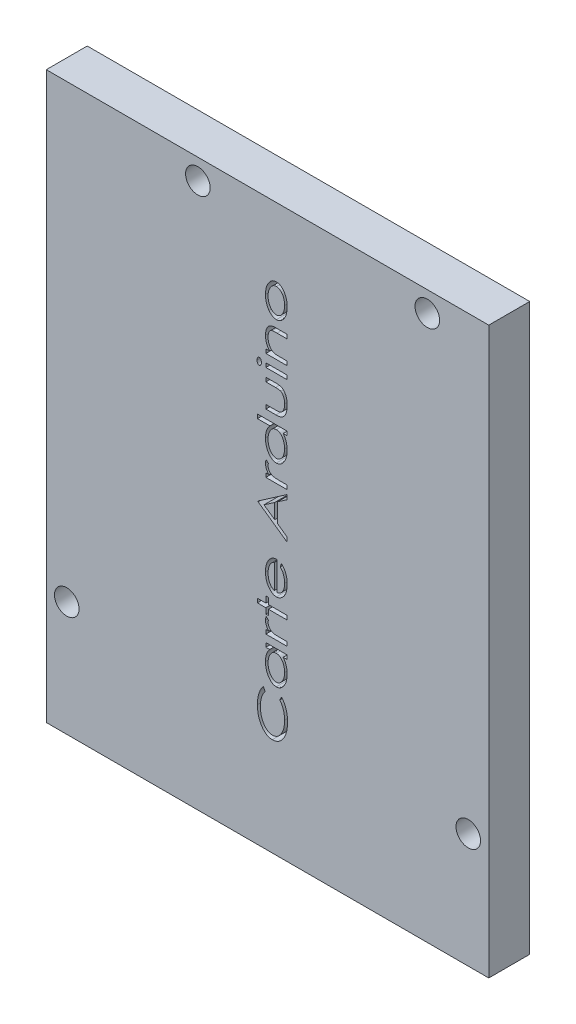
from build123d import *

# Parameters (mm, degrees)
ESQUISSE1_W             = 54
ESQUISSE1_H             = 69
EXTRUSION1_DEPTH        = 5
ESQUISSE2_W             = 2.557692307
ESQUISSE2_H             = 0.493589744
ENL_V_MAT_EXTRU_1_DEPTH = 2
ESQUISSE3_R             = 1.5
ENL_V_MAT_EXTRU_2_DEPTH = 10


with BuildPart() as part:
    # Esquisse1 → Extrusion1 (new body)
    with BuildSketch(Plane.XY):
        with Locations((-27, 34.5)):
            Rectangle(ESQUISSE1_W, ESQUISSE1_H)
    extrude(amount=EXTRUSION1_DEPTH)

    # Esquisse2 → Enlèv. mat.-Extru.1 (cut)
    # profile 1 of 13: a face of its own
    with BuildSketch(Plane.XY.offset(5)):
        with BuildLine():
            add(Edge.make_bspline(
                [(-27.247086247, 58.62309085), (-27.246056917, 58.695359189), (-27.244040574, 58.836924758), (-27.222894505, 59.044201095), (-27.190193832, 59.241931741), (-27.145057477, 59.430680366), (-27.085221102, 59.609711218), (-27.012730993, 59.779538621), (-26.927829477, 59.940485268), (-26.859649082, 60.039734744), (-26.825712048, 60.089136523)],
                knots=[0, 0, 0, 0, 1.118029041, 2.190093497, 3.220499173, 4.217871291, 5.190012594, 6.137901036, 7.073133634, 8, 8, 8, 8], degree=3))
            add(Edge.make_bspline(
                [(-26.825712048, 60.089136523), (-26.793825706, 60.131195961), (-26.731960495, 60.212798798), (-26.628242, 60.320163616), (-26.520873191, 60.411783315), (-26.409353075, 60.487943864), (-26.291948903, 60.545461323), (-26.170867758, 60.587677441), (-26.044998318, 60.612838229), (-25.959469942, 60.61612538), (-25.91635708, 60.617782356)],
                knots=[0, 0, 0, 0, 1.156785325, 2.244370538, 3.266277709, 4.248660306, 5.197713603, 6.124949243, 7.054830596, 8, 8, 8, 8], degree=3))
            add(Edge.make_bspline(
                [(-25.91635708, 60.617782356), (-25.872973596, 60.61632315), (-25.786768191, 60.613423625), (-25.660178383, 60.585192914), (-25.537529653, 60.541502956), (-25.419085821, 60.47998906), (-25.305490899, 60.400071241), (-25.195749892, 60.303632285), (-25.091270881, 60.188627856), (-24.991300429, 60.058708552), (-24.898887633, 59.915167849), (-24.819190489, 59.759421342), (-24.751002632, 59.594396123), (-24.695527997, 59.41913722), (-24.652281643, 59.234190353), (-24.621658443, 59.039226628), (-24.60324539, 58.83448484), (-24.600867211, 58.694644175), (-24.59965035, 58.62309085)],
                knots=[0, 0, 0, 0, 0.789098804, 1.567983354, 2.350210273, 3.155490411, 3.990287269, 4.874001324, 5.810856407, 6.815460693, 7.856857624, 8.915312001, 9.997439552, 11.105303834, 12.259580059, 13.453399675, 14.696961864, 16, 16, 16, 16], degree=3))
            add(Edge.make_bspline(
                [(-24.59965035, 58.62309085), (-24.600874189, 58.551304085), (-24.603270144, 58.410764539), (-24.621634473, 58.20509065), (-24.652157599, 58.009392667), (-24.695801162, 57.823859073), (-24.750698625, 57.647949192), (-24.819225002, 57.482564438), (-24.898878623, 57.326804298), (-24.991302738, 57.183267141), (-25.091270316, 57.053346936), (-25.19575003, 56.938342728), (-25.305490866, 56.841903718), (-25.419085829, 56.761985912), (-25.537529651, 56.700472013), (-25.660178383, 56.656782056), (-25.786768191, 56.628551344), (-25.872973596, 56.625651819), (-25.91635708, 56.624192613)],
                knots=[0, 0, 0, 0, 1.305249044, 2.555333257, 3.751483921, 4.903955647, 6.018189604, 7.098625447, 8.155425126, 9.195194025, 10.198227797, 11.13361828, 12.01595081, 12.849442617, 13.653463848, 14.434467899, 15.212134806, 16, 16, 16, 16], degree=3))
            add(Edge.make_bspline(
                [(-25.91635708, 56.624192613), (-25.959240149, 56.625852754), (-26.044542215, 56.62915507), (-26.170106978, 56.654414645), (-26.291175508, 56.695967174), (-26.407109931, 56.755391538), (-26.519067211, 56.830222516), (-26.62677458, 56.921415595), (-26.729809143, 57.029441458), (-26.791672732, 57.110825446), (-26.823608683, 57.152838446)],
                knots=[0, 0, 0, 0, 0.941758557, 1.873325597, 2.802242128, 3.746126364, 4.727432054, 5.755112354, 6.841117657, 8, 8, 8, 8], degree=3))
            add(Edge.make_bspline(
                [(-26.823608683, 57.152838446), (-26.857837558, 57.202204805), (-26.926530099, 57.301276146), (-27.011295639, 57.462789792), (-27.084603731, 57.632603214), (-27.144209136, 57.812327994), (-27.190515169, 58.001554775), (-27.222753325, 58.200376893), (-27.244070877, 58.408550749), (-27.246067199, 58.550586746), (-27.247086247, 58.62309085)],
                knots=[0, 0, 0, 0, 0.925913955, 1.858179155, 2.807793909, 3.776850706, 4.775415181, 5.809663793, 6.881914668, 8, 8, 8, 8], degree=3))
        make_face()
        with BuildLine():
            add(Edge.make_bspline(
                [(-26.932983683, 58.620987485), (-26.9320254, 58.570473121), (-26.930140557, 58.471116588), (-26.915718607, 58.324726045), (-26.892784311, 58.183684724), (-26.860740095, 58.047842504), (-26.818476669, 57.917816603), (-26.767016844, 57.793184754), (-26.706878334, 57.67351984), (-26.637203979, 57.561273518), (-26.561987278, 57.457904358), (-26.480912522, 57.367748769), (-26.396753644, 57.290267093), (-26.307899047, 57.227428605), (-26.215209271, 57.17804667), (-26.118262026, 57.143876142), (-26.01762337, 57.121613369), (-25.94896007, 57.119068619), (-25.914253715, 57.117782356)],
                knots=[0, 0, 0, 0, 1.211864499, 2.383612265, 3.525817359, 4.638387763, 5.728978597, 6.802613839, 7.870934821, 8.938490256, 9.969195146, 10.934099454, 11.843161065, 12.708195667, 13.538452507, 14.354344749, 15.168191808, 16, 16, 16, 16], degree=3))
            add(Edge.make_bspline(
                [(-25.914253715, 57.117782356), (-25.891796235, 57.118591174), (-25.846938457, 57.12020675), (-25.780087104, 57.129082226), (-25.714650569, 57.145920715), (-25.64972307, 57.167118897), (-25.586814105, 57.196548181), (-25.524424656, 57.230673496), (-25.464389899, 57.272756184), (-25.404834236, 57.319418556), (-25.347452976, 57.37153099), (-25.294581575, 57.42962827), (-25.243295592, 57.490849193), (-25.196145286, 57.557056557), (-25.152380658, 57.627921129), (-25.111781876, 57.702780148), (-25.074634401, 57.78217285), (-25.02948829, 57.894428026), (-24.982790766, 58.042191052), (-24.943142385, 58.227893178), (-24.917626496, 58.421626062), (-24.915057738, 58.553832192), (-24.913752914, 58.620987485)],
                knots=[0, 0, 0, 0, 0.676698543, 1.351674039, 2.02606196, 2.70946426, 3.405653627, 4.114679009, 4.848838336, 5.610721482, 6.392982434, 7.180011484, 7.97496537, 8.797371187, 9.625630927, 10.482387151, 11.360987975, 12.264255974, 14.125429088, 16.019773843, 17.978208304, 20, 20, 20, 20], degree=3))
            add(Edge.make_bspline(
                [(-24.913752914, 58.620987485), (-24.915053851, 58.688144143), (-24.917614958, 58.820352959), (-24.94318625, 59.014066385), (-24.982586966, 59.199621132), (-25.029865027, 59.347171558), (-25.074466021, 59.459634555), (-25.111789781, 59.539196033), (-25.152420717, 59.61402248), (-25.195884891, 59.684875958), (-25.243765692, 59.750530853), (-25.294321818, 59.812316776), (-25.34744446, 59.870477235), (-25.405110136, 59.922422209), (-25.463882382, 59.970170846), (-25.524926912, 60.010936325), (-25.586356693, 60.046584127), (-25.650113265, 60.074323253), (-25.714344207, 60.097341658), (-25.780298429, 60.112293942), (-25.846830863, 60.122966882), (-25.891774966, 60.123783955), (-25.914253715, 60.124192613)],
                knots=[0, 0, 0, 0, 2.021608502, 3.979865511, 5.874038621, 7.728335502, 8.638053201, 9.516574416, 10.373253009, 11.201437702, 12.018055674, 12.818372735, 13.605330473, 14.387520545, 15.15371191, 15.883845854, 16.596257792, 17.289495649, 17.975116066, 18.647787728, 19.323692347, 20, 20, 20, 20], degree=3))
            add(Edge.make_bspline(
                [(-25.914253715, 60.124192613), (-25.948962334, 60.122910636), (-26.017630114, 60.120374364), (-26.118235702, 60.098049004), (-26.215412779, 60.064080943), (-26.307701599, 60.013700671), (-26.396764407, 59.951047437), (-26.481119439, 59.873471934), (-26.56198056, 59.782627131), (-26.637012445, 59.678696399), (-26.706903203, 59.566368558), (-26.767010651, 59.446682414), (-26.818476451, 59.322055882), (-26.86074747, 59.192030121), (-26.892701114, 59.05640641), (-26.915732505, 58.915852608), (-26.930137723, 58.770157977), (-26.932024402, 58.671268059), (-26.932983683, 58.620987485)],
                knots=[0, 0, 0, 0, 0.832088621, 1.646210054, 2.46237736, 3.295543021, 4.160869255, 5.07023734, 6.039646893, 7.075221282, 8.143136624, 9.211817771, 10.28581497, 11.376773477, 12.489718964, 13.62677417, 14.793333416, 16, 16, 16, 16], degree=3))
        make_face(mode=Mode.SUBTRACT)
    # profile 2 of 13: a face of its own
    with BuildSketch(Plane.XY.offset(5)):
        with BuildLine():
            Line((-27.202214452, 52.406243895), (-27.202214452, 52.899833639))
            Line((-27.202214452, 52.899833639), (-26.740876311, 52.899833639))
            add(Edge.make_bspline(
                [(-26.740876311, 52.899833639), (-26.783101554, 52.949236619), (-26.866548769, 53.046868767), (-26.971778406, 53.207031377), (-27.059929406, 53.37409872), (-27.129809479, 53.549548525), (-27.181886544, 53.732778885), (-27.219880257, 53.923356998), (-27.242631642, 54.121804372), (-27.245585345, 54.256678819), (-27.247086247, 54.325214248)],
                knots=[0, 0, 0, 0, 1.006293527, 1.988677578, 2.962297023, 3.929401087, 4.909439067, 5.910216826, 6.938092521, 8, 8, 8, 8], degree=3))
            add(Edge.make_bspline(
                [(-27.247086247, 54.325214248), (-27.246771523, 54.360285277), (-27.246151904, 54.429332033), (-27.238565724, 54.531525017), (-27.227956202, 54.630834555), (-27.211257705, 54.726829023), (-27.192197009, 54.820250171), (-27.166701205, 54.910216606), (-27.137185758, 54.99748873), (-27.103848447, 55.08145454), (-27.066057425, 55.160903959), (-27.025338081, 55.235730019), (-26.981495325, 55.304981585), (-26.934063485, 55.368460743), (-26.884176833, 55.426996644), (-26.831224109, 55.480586433), (-26.773781302, 55.52738243), (-26.713509903, 55.570614717), (-26.646953209, 55.608173729), (-26.57219304, 55.639592131), (-26.489442006, 55.666782632), (-26.398064923, 55.689267194), (-26.298111134, 55.705371813), (-26.189857926, 55.718412116), (-26.073017317, 55.724831783), (-25.992317496, 55.726101898), (-25.950712048, 55.726756715)],
                knots=[0, 0, 0, 0, 1.149170785, 2.262451882, 3.356998706, 4.421050154, 5.454614688, 6.480458824, 7.483253189, 8.473211069, 9.439415136, 10.364928947, 11.263750434, 12.123163779, 12.959780803, 13.78303711, 14.588207165, 15.385137629, 16.211701127, 17.08670854, 18.038628498, 19.064100821, 20.167190579, 21.354800202, 22.636245781, 24, 24, 24, 24], degree=3))
            Line((-25.950712048, 55.726756715), (-24.644522145, 55.726756715))
            Line((-24.644522145, 55.726756715), (-24.644522145, 55.233166972))
            Line((-24.644522145, 55.233166972), (-25.847647145, 55.233166972))
            add(Edge.make_bspline(
                [(-25.847647145, 55.233166972), (-25.882468938, 55.232949892), (-25.949077104, 55.232534654), (-26.044463121, 55.231678734), (-26.130697351, 55.227862758), (-26.208042207, 55.223564089), (-26.276435173, 55.2194712), (-26.335704965, 55.211846076), (-26.385986658, 55.205076746), (-26.41606306, 55.197851859), (-26.429578234, 55.194605273)],
                knots=[0, 0, 0, 0, 1.430316998, 2.735952994, 3.917633013, 4.975117572, 5.918238547, 6.730267318, 7.429431135, 8, 8, 8, 8], degree=3))
            add(Edge.make_bspline(
                [(-26.429578234, 55.194605273), (-26.450076374, 55.189272524), (-26.490467075, 55.178764571), (-26.547464348, 55.154390348), (-26.600538999, 55.12471205), (-26.650123673, 55.089433768), (-26.695655873, 55.047915459), (-26.737279099, 55.000653965), (-26.774402068, 54.947502166), (-26.808299677, 54.889252231), (-26.837168446, 54.825291165), (-26.863484061, 54.757097235), (-26.884981137, 54.684126021), (-26.902446468, 54.606327929), (-26.916430141, 54.523965814), (-26.926167828, 54.436656121), (-26.931642889, 54.34491662), (-26.932530368, 54.282219305), (-26.932983683, 54.250194215)],
                knots=[0, 0, 0, 0, 0.876055379, 1.726229402, 2.558139535, 3.39066867, 4.240236547, 5.104234556, 5.993027052, 6.920950632, 7.890921188, 8.895658824, 9.945928722, 11.037651764, 12.195937577, 13.403628433, 14.673802368, 16, 16, 16, 16], degree=3))
            add(Edge.make_bspline(
                [(-26.932983683, 54.250194215), (-26.932506265, 54.21301591), (-26.931561955, 54.139478857), (-26.922206808, 54.030831775), (-26.906888202, 53.925210803), (-26.884988206, 53.822719957), (-26.857571079, 53.723012139), (-26.824935779, 53.625729237), (-26.784651773, 53.532075611), (-26.739439385, 53.441794182), (-26.689252962, 53.357347878), (-26.636909798, 53.278767171), (-26.5806804, 53.208546243), (-26.521500138, 53.145805003), (-26.459860283, 53.090088058), (-26.394957494, 53.041982918), (-26.327035923, 53.001700321), (-26.279304597, 52.980922295), (-26.255700029, 52.97064694)],
                knots=[0, 0, 0, 0, 1.167408504, 2.309082687, 3.421841772, 4.51735265, 5.598209192, 6.668245375, 7.737072533, 8.797321709, 9.837099145, 10.820367752, 11.760329686, 12.65858699, 13.526586695, 14.366288304, 15.192080716, 16, 16, 16, 16], degree=3))
            add(Edge.make_bspline(
                [(-26.255700029, 52.97064694), (-26.238505128, 52.964684474), (-26.201363617, 52.951805365), (-26.139304797, 52.939031964), (-26.068160813, 52.925756276), (-25.987062696, 52.91669266), (-25.896360684, 52.908970203), (-25.796062164, 52.90329213), (-25.685932385, 52.900966723), (-25.60926617, 52.900221899), (-25.569301792, 52.899833639)],
                knots=[0, 0, 0, 0, 0.629771554, 1.360325789, 2.190835342, 3.136705928, 4.184790911, 5.34423062, 6.615607005, 8, 8, 8, 8], degree=3))
            Line((-25.569301792, 52.899833639), (-24.644522145, 52.899833639))
            Line((-24.644522145, 52.899833639), (-24.644522145, 52.406243895))
            Line((-24.644522145, 52.406243895), (-27.202214452, 52.406243895))
        make_face()
    # profile 3 of 13: a face of its own
    with BuildSketch(Plane.XY.offset(5)):
        with BuildLine():
            add(Edge.make_bspline(
                [(-28.279137529, 51.170166171), (-28.278232265, 51.198737664), (-28.276475563, 51.254181827), (-28.261857828, 51.334160167), (-28.236136164, 51.407174208), (-28.202542431, 51.472350412), (-28.162149151, 51.527518494), (-28.115205789, 51.567784248), (-28.06359254, 51.594356392), (-28.026793572, 51.597158795), (-28.008504516, 51.598551587)],
                knots=[0, 0, 0, 0, 1.232622349, 2.391954591, 3.492533549, 4.561789548, 5.54829387, 6.421376584, 7.215425493, 8, 8, 8, 8], degree=3))
            add(Edge.make_bspline(
                [(-28.008504516, 51.598551587), (-27.990687914, 51.597124707), (-27.954580413, 51.594232963), (-27.903848526, 51.567759882), (-27.857659875, 51.527266506), (-27.81723984, 51.472383616), (-27.783686275, 51.407164732), (-27.757953146, 51.334162872), (-27.743338655, 51.254181085), (-27.741581492, 51.198737412), (-27.740675991, 51.170166171)],
                knots=[0, 0, 0, 0, 0.768134372, 1.55671721, 2.426123539, 3.417176527, 4.491362752, 5.597016362, 6.761694161, 8, 8, 8, 8], degree=3))
            add(Edge.make_bspline(
                [(-27.740675991, 51.170166171), (-27.741588883, 51.142295072), (-27.743366907, 51.088011053), (-27.758035581, 51.009436807), (-27.783839955, 50.937198575), (-27.817227026, 50.87215036), (-27.857662749, 50.817273709), (-27.903847877, 50.776778932), (-27.954580564, 50.750306169), (-27.990687963, 50.747414384), (-28.008504516, 50.745987485)],
                knots=[0, 0, 0, 0, 1.217058856, 2.370442829, 3.474794704, 4.557074952, 5.555595552, 6.431552882, 7.226077714, 8, 8, 8, 8], degree=3))
            add(Edge.make_bspline(
                [(-28.008504516, 50.745987485), (-28.02679352, 50.747380297), (-28.063592384, 50.750182741), (-28.115206448, 50.776754562), (-28.162146252, 50.817021729), (-28.202555231, 50.872183576), (-28.235982404, 50.937189184), (-28.261775448, 51.009439453), (-28.276447287, 51.088010336), (-28.278224865, 51.142294829), (-28.279137529, 51.170166171)],
                knots=[0, 0, 0, 0, 0.790458961, 1.590463383, 2.470094379, 3.463997666, 4.541273283, 5.640518464, 6.788569012, 8, 8, 8, 8], degree=3))
        make_face()
    # profile 4 of 13: a face of its own
    with BuildSketch(Plane.XY.offset(5)):
        with Locations((-25.923368299, 51.172269536)):
            Rectangle(ESQUISSE2_W, ESQUISSE2_H)
    # profile 5 of 13: a face of its own
    with BuildSketch(Plane.XY.offset(5)):
        with BuildLine():
            Line((-27.202214452, 46.528038767), (-27.202214452, 47.02162851))
            Line((-27.202214452, 47.02162851), (-26.015916375, 47.02162851))
            add(Edge.make_bspline(
                [(-26.015916375, 47.02162851), (-25.981092908, 47.022007188), (-25.914473381, 47.022731622), (-25.818599551, 47.025176728), (-25.731104432, 47.030555662), (-25.652125425, 47.039166896), (-25.581432295, 47.048777219), (-25.519234221, 47.060187454), (-25.465252313, 47.074738998), (-25.432962584, 47.087277985), (-25.417859484, 47.093142933)],
                knots=[0, 0, 0, 0, 1.380257365, 2.640520856, 3.8007194, 4.853282788, 5.78857991, 6.627858729, 7.358198781, 8, 8, 8, 8], degree=3))
            add(Edge.make_bspline(
                [(-25.417859484, 47.093142933), (-25.398702235, 47.102548211), (-25.360153301, 47.121473863), (-25.306090405, 47.157591198), (-25.255535878, 47.200099758), (-25.20752691, 47.248058987), (-25.162508579, 47.302145726), (-25.121463527, 47.362879109), (-25.082512546, 47.428897789), (-25.047948693, 47.501115943), (-25.016420589, 47.577855759), (-24.989377175, 47.658803603), (-24.965124866, 47.742836745), (-24.946446163, 47.830988457), (-24.931828947, 47.922498543), (-24.921329366, 48.017724907), (-24.914918766, 48.116457917), (-24.914145785, 48.183611247), (-24.913752914, 48.217742292)],
                knots=[0, 0, 0, 0, 0.789107134, 1.587870916, 2.398439957, 3.230141982, 4.096078469, 4.998061595, 5.939960955, 6.930173971, 7.958043701, 9.008265343, 10.086945814, 11.192947644, 12.340374094, 13.515114844, 14.737043569, 16, 16, 16, 16], degree=3))
            add(Edge.make_bspline(
                [(-24.913752914, 48.217742292), (-24.914115302, 48.251876502), (-24.914825829, 48.318802787), (-24.921615499, 48.417001997), (-24.930772785, 48.511423884), (-24.945997378, 48.601604625), (-24.96367318, 48.688433623), (-24.987175519, 48.770869342), (-25.013530813, 48.849712021), (-25.044280234, 48.923966386), (-25.078983954, 48.993097962), (-25.114641635, 49.058090816), (-25.155341004, 49.116212062), (-25.196919378, 49.169611521), (-25.241405544, 49.217435855), (-25.289503632, 49.258357036), (-25.338893563, 49.295790434), (-25.374817209, 49.315196814), (-25.3926191, 49.324813606)],
                knots=[0, 0, 0, 0, 1.295787742, 2.540626003, 3.736131532, 4.895866378, 6.011410103, 7.098644264, 8.148107331, 9.166499869, 10.14667766, 11.084406019, 11.977846222, 12.837053895, 13.653115956, 14.451967092, 15.232875428, 16, 16, 16, 16], degree=3))
            add(Edge.make_bspline(
                [(-25.3926191, 49.324813606), (-25.406527482, 49.330958264), (-25.436954963, 49.344400983), (-25.48949511, 49.359323035), (-25.55215903, 49.371533608), (-25.625195801, 49.381826569), (-25.708445895, 49.390232031), (-25.802021052, 49.395431267), (-25.905579366, 49.39898163), (-25.978052338, 49.399541257), (-26.015916375, 49.399833639)],
                knots=[0, 0, 0, 0, 0.577123795, 1.262578488, 2.068793637, 3.001746774, 4.063685736, 5.24670414, 6.561520315, 8, 8, 8, 8], degree=3))
            Line((-26.015916375, 49.399833639), (-27.202214452, 49.399833639))
            Line((-27.202214452, 49.399833639), (-27.202214452, 49.893423382))
            Line((-27.202214452, 49.893423382), (-25.957022145, 49.893423382))
            add(Edge.make_bspline(
                [(-25.957022145, 49.893423382), (-25.91469941, 49.893010197), (-25.832519716, 49.8922079), (-25.71323533, 49.882449801), (-25.60166556, 49.869184704), (-25.49822481, 49.849059223), (-25.403481421, 49.822182557), (-25.316322843, 49.791021076), (-25.237485495, 49.75299165), (-25.16590649, 49.70918776), (-25.100561319, 49.659147777), (-25.039554679, 49.603592234), (-24.982011391, 49.542331129), (-24.927570284, 49.475680775), (-24.878225543, 49.402108085), (-24.830910134, 49.32385852), (-24.788232864, 49.239083966), (-24.748987739, 49.148784366), (-24.71391632, 49.052311818), (-24.683115281, 48.95005943), (-24.65722665, 48.841894067), (-24.636441384, 48.727858337), (-24.619467128, 48.607899191), (-24.607828757, 48.481787535), (-24.60063848, 48.349872212), (-24.599984129, 48.260052886), (-24.59965035, 48.214236683)],
                knots=[0, 0, 0, 0, 1.226876808, 2.382274251, 3.468255488, 4.483625959, 5.434028297, 6.321591031, 7.164190345, 7.967304403, 8.750706248, 9.547073138, 10.357246674, 11.185942296, 12.039291661, 12.923718533, 13.835955015, 14.788963051, 15.777265547, 16.810613333, 17.883918967, 19.000404961, 20.170573262, 21.395801997, 22.671617045, 24, 24, 24, 24], degree=3))
            add(Edge.make_bspline(
                [(-24.59965035, 48.214236683), (-24.599984884, 48.168420576), (-24.600640715, 48.078601435), (-24.607820367, 47.94668478), (-24.619518014, 47.820347343), (-24.636439922, 47.699916518), (-24.657227899, 47.585180514), (-24.683123296, 47.476319826), (-24.713896696, 47.373352572), (-24.749068315, 47.276234402), (-24.787997135, 47.184947281), (-24.831938616, 47.100161471), (-24.877971587, 47.020321009), (-24.928397957, 46.946557594), (-24.9831855, 46.879159918), (-25.041668055, 46.817838413), (-25.103592258, 46.76234413), (-25.169225806, 46.711557442), (-25.241700736, 46.667450823), (-25.322681526, 46.630563924), (-25.411442295, 46.598284184), (-25.509131059, 46.57261688), (-25.614755504, 46.552283729), (-25.729131099, 46.538946159), (-25.851688119, 46.529251074), (-25.936434653, 46.52845137), (-25.980159164, 46.528038767)],
                knots=[0, 0, 0, 0, 1.313570353, 2.575158976, 3.786725367, 4.950481729, 6.0611077, 7.128961893, 8.157204859, 9.140784589, 10.089316424, 11.000395615, 11.877319077, 12.73046734, 13.559348208, 14.365098571, 15.157559091, 15.941616971, 16.741494237, 17.583943296, 18.489088665, 19.446502762, 20.476861613, 21.570682249, 22.746606786, 24, 24, 24, 24], degree=3))
            Line((-25.980159164, 46.528038767), (-27.202214452, 46.528038767))
        make_face()
    # profile 6 of 13: a face of its own
    with BuildSketch(Plane.XY.offset(5)):
        with BuildLine():
            Line((-28.234265734, 45.495987485), (-24.644522145, 45.495987485))
            Line((-24.644522145, 45.495987485), (-24.644522145, 45.002397741))
            Line((-24.644522145, 45.002397741), (-25.086929997, 45.002397741))
            add(Edge.make_bspline(
                [(-25.086929997, 45.002397741), (-25.046610113, 44.94938205), (-24.966110498, 44.843534951), (-24.864346755, 44.671586337), (-24.780853308, 44.489376889), (-24.713382385, 44.298076014), (-24.662557946, 44.097517543), (-24.626455161, 43.888184218), (-24.603108227, 43.669861158), (-24.600816784, 43.520988341), (-24.59965035, 43.445206235)],
                knots=[0, 0, 0, 0, 0.959913953, 1.916491209, 2.874041634, 3.846160317, 4.837679676, 5.853859624, 6.90753032, 8, 8, 8, 8], degree=3))
            add(Edge.make_bspline(
                [(-24.59965035, 43.445206235), (-24.600864582, 43.37785537), (-24.603251232, 43.245473084), (-24.622003706, 43.050616556), (-24.651727949, 42.863388829), (-24.693942768, 42.68335742), (-24.74840081, 42.511008854), (-24.815482772, 42.346095178), (-24.893862968, 42.188432501), (-24.984463854, 42.040549418), (-25.082662168, 41.904834235), (-25.187005892, 41.78511418), (-25.297996957, 41.684590128), (-25.414004532, 41.601721421), (-25.535583705, 41.537037309), (-25.662495163, 41.491031527), (-25.794741523, 41.462640241), (-25.884900865, 41.45924074), (-25.930379516, 41.457525946)],
                knots=[0, 0, 0, 0, 1.226021397, 2.409820796, 3.560528837, 4.675169253, 5.773241012, 6.84782229, 7.91342823, 8.975196037, 10.001589918, 10.960246305, 11.860978357, 12.721634312, 13.549600474, 14.359895992, 15.172690086, 16, 16, 16, 16], degree=3))
            add(Edge.make_bspline(
                [(-25.930379516, 41.457525946), (-25.974918403, 41.459271576), (-26.063445071, 41.462741237), (-26.193545759, 41.490860469), (-26.318405878, 41.537991319), (-26.438062434, 41.603076321), (-26.552846419, 41.686183263), (-26.661828715, 41.788507934), (-26.766043376, 41.908756023), (-26.863897187, 42.04561448), (-26.953486012, 42.194970422), (-27.031953427, 42.35381851), (-27.099121489, 42.519816245), (-27.152628853, 42.693829994), (-27.195742733, 42.874769725), (-27.225674469, 43.063438156), (-27.243220587, 43.25930693), (-27.24578415, 43.392352617), (-27.247086247, 43.459929792)],
                knots=[0, 0, 0, 0, 0.810112008, 1.610200051, 2.409779071, 3.23202922, 4.082076825, 4.982045036, 5.946842608, 6.973913408, 8.040473165, 9.113409892, 10.195590852, 11.296150651, 12.423889662, 13.578489405, 14.770055223, 16, 16, 16, 16], degree=3))
            add(Edge.make_bspline(
                [(-27.247086247, 43.459929792), (-27.245531004, 43.537590454), (-27.242482214, 43.689830946), (-27.216859615, 43.91217821), (-27.174997746, 44.123356907), (-27.125448495, 44.290873466), (-27.077927441, 44.419059471), (-27.036761068, 44.510866858), (-26.99254006, 44.600329681), (-26.944633174, 44.686995663), (-26.891480576, 44.770418513), (-26.833928524, 44.850559062), (-26.773364562, 44.928863813), (-26.729268907, 44.977887459), (-26.707222465, 45.002397741)],
                knots=[0, 0, 0, 0, 1.669663403, 3.27309055, 4.805769352, 6.294228257, 7.024219572, 7.744246808, 8.456744993, 9.169934142, 9.872633594, 10.582485752, 11.291287424, 12, 12, 12, 12], degree=3))
            Line((-26.707222465, 45.002397741), (-28.234265734, 45.002397741))
            Line((-28.234265734, 45.002397741), (-28.234265734, 45.495987485))
        make_face()
        with BuildLine():
            add(Edge.make_bspline(
                [(-26.932983683, 43.478860081), (-26.931357393, 43.411244538), (-26.92815572, 43.278130044), (-26.903139149, 43.082371365), (-26.861864788, 42.894381716), (-26.813553597, 42.744298812), (-26.768305339, 42.629459926), (-26.728959319, 42.549170199), (-26.689081145, 42.47201666), (-26.643537734, 42.400764452), (-26.596138897, 42.332726574), (-26.544147214, 42.270283166), (-26.489954629, 42.211166076), (-26.432105375, 42.157689068), (-26.372161408, 42.109702659), (-26.311559277, 42.067071877), (-26.249865006, 42.030870779), (-26.186491264, 42.002676279), (-26.123125369, 41.978662049), (-26.058409836, 41.962650351), (-25.992808697, 41.953489779), (-25.948869982, 41.951907694), (-25.926873907, 41.95111569)],
                knots=[0, 0, 0, 0, 2.015966359, 3.968826295, 5.874616381, 7.748145086, 8.664462763, 9.552923123, 10.413471098, 11.252728875, 12.072663861, 12.884741005, 13.673821861, 14.462902716, 15.231368581, 15.962219401, 16.671105762, 17.360397388, 18.028503583, 18.689446069, 19.34392613, 20, 20, 20, 20], degree=3))
            add(Edge.make_bspline(
                [(-25.926873907, 41.95111569), (-25.905105501, 41.951854202), (-25.861355163, 41.95333847), (-25.796278325, 41.963391097), (-25.731820719, 41.979841259), (-25.667951504, 42.001983091), (-25.605316685, 42.031963981), (-25.543399311, 42.068125571), (-25.481496044, 42.109889994), (-25.421656782, 42.159412216), (-25.363074184, 42.213232927), (-25.308341985, 42.272791322), (-25.256183003, 42.336073378), (-25.20712798, 42.403773718), (-25.162233262, 42.476701297), (-25.120189351, 42.553625674), (-25.081632937, 42.635121528), (-25.034878309, 42.749772888), (-24.985565502, 42.899140045), (-24.944636735, 43.085702813), (-24.918413442, 43.27806012), (-24.915317324, 43.408662441), (-24.913752914, 43.47465335)],
                knots=[0, 0, 0, 0, 0.649979245, 1.306334096, 1.961389049, 2.634595035, 3.321409752, 4.03124086, 4.774555847, 5.548432434, 6.348427785, 7.148423135, 7.961582551, 8.796405583, 9.642701596, 10.517160907, 11.41310634, 12.333269067, 14.21359944, 16.101491156, 18.030156436, 20, 20, 20, 20], degree=3))
            add(Edge.make_bspline(
                [(-24.913752914, 43.47465335), (-24.915422401, 43.541563258), (-24.918731835, 43.674199186), (-24.94358503, 43.870491645), (-24.985905731, 44.061130744), (-25.034556996, 44.214733025), (-25.0800734, 44.332901694), (-25.117879528, 44.416185586), (-25.158707237, 44.494301409), (-25.201923705, 44.567324819), (-25.248525052, 44.634836559), (-25.297338923, 44.697667523), (-25.350306814, 44.754445352), (-25.405511273, 44.806305032), (-25.46292256, 44.85285266), (-25.522632625, 44.892770119), (-25.583929971, 44.926928302), (-25.647306342, 44.954018064), (-25.712095745, 44.976240093), (-25.779058148, 44.991532799), (-25.847842221, 45.000957133), (-25.89435842, 45.001915577), (-25.917759324, 45.002397741)],
                knots=[0, 0, 0, 0, 1.987907074, 3.940640604, 5.868205707, 7.783434005, 8.722293397, 9.629808557, 10.499550393, 11.340393725, 12.149433782, 12.935771395, 13.70238882, 14.454109182, 15.185110196, 15.895839765, 16.585877225, 17.267051451, 17.941251499, 18.618449274, 19.304983272, 20, 20, 20, 20], degree=3))
            add(Edge.make_bspline(
                [(-25.917759324, 45.002397741), (-25.953147682, 45.001029411), (-26.023115472, 44.998324028), (-26.125823435, 44.977329149), (-26.224118916, 44.942937424), (-26.317403586, 44.89361091), (-26.40647883, 44.831290964), (-26.490963653, 44.754962205), (-26.570019593, 44.664248271), (-26.644657367, 44.561861822), (-26.711435744, 44.448951793), (-26.771938133, 44.329486148), (-26.821243669, 44.202935802), (-26.86198484, 44.070257952), (-26.894565531, 43.931431668), (-26.916138729, 43.786007879), (-26.931130385, 43.634589032), (-26.932357429, 43.531482947), (-26.932983683, 43.478860081)],
                knots=[0, 0, 0, 0, 0.838952033, 1.658726862, 2.475797891, 3.301530857, 4.153550984, 5.048566245, 5.995133624, 7.00310499, 8.049891089, 9.103583459, 10.176296665, 11.267009123, 12.393921279, 13.555125413, 14.752194814, 16, 16, 16, 16], degree=3))
        make_face(mode=Mode.SUBTRACT)
    # profile 7 of 13: a face of its own
    with BuildSketch(Plane.XY.offset(5)):
        with BuildLine():
            Line((-27.202214452, 39.303679792), (-27.202214452, 39.797269536))
            Line((-27.202214452, 39.797269536), (-26.825712048, 39.797269536))
            add(Edge.make_bspline(
                [(-26.825712048, 39.797269536), (-26.861074289, 39.833510817), (-26.930088836, 39.904240939), (-27.018162852, 40.019210778), (-27.092405089, 40.136106007), (-27.150016668, 40.256874637), (-27.193669279, 40.380398171), (-27.224532011, 40.506282302), (-27.243340052, 40.63477595), (-27.245832196, 40.721285726), (-27.247086247, 40.764817613)],
                knots=[0, 0, 0, 0, 1.118742704, 2.18338882, 3.19566548, 4.175678933, 5.135093587, 6.087636434, 7.037694951, 8, 8, 8, 8], degree=3))
            add(Edge.make_bspline(
                [(-27.247086247, 40.764817613), (-27.245920604, 40.798533811), (-27.243544425, 40.867264724), (-27.226365141, 40.971936928), (-27.19941613, 41.080031928), (-27.172997205, 41.151590371), (-27.159446023, 41.188295177)],
                knots=[0, 0, 0, 0, 0.930225898, 1.896277749, 2.920927934, 4, 4, 4, 4], degree=3))
            Line((-27.159446023, 41.188295177), (-26.887410766, 40.930983478))
            add(Edge.make_bspline(
                [(-26.887410766, 40.930983478), (-26.894170673, 40.907202423), (-26.907086149, 40.861766343), (-26.922115941, 40.796139478), (-26.93108299, 40.736087312), (-26.932373184, 40.698002847), (-26.932983683, 40.679981876)],
                knots=[0, 0, 0, 0, 1.159041688, 2.214464814, 3.155112748, 4, 4, 4, 4], degree=3))
            add(Edge.make_bspline(
                [(-26.932983683, 40.679981876), (-26.931386719, 40.640578057), (-26.928188489, 40.561664301), (-26.901399835, 40.444978981), (-26.859947893, 40.330185415), (-26.81111335, 40.238256608), (-26.763973954, 40.167419874), (-26.723275344, 40.116844731), (-26.677553066, 40.069877293), (-26.62734899, 40.026387204), (-26.573238859, 39.985114047), (-26.513521059, 39.948466151), (-26.449682489, 39.914476567), (-26.404726375, 39.895331115), (-26.381901952, 39.885610882)],
                knots=[0, 0, 0, 0, 1.378024059, 2.759759239, 4.170357592, 5.641627337, 6.390463309, 7.146903678, 7.91065367, 8.681861014, 9.470576576, 10.290134189, 11.13189339, 12, 12, 12, 12], degree=3))
            add(Edge.make_bspline(
                [(-26.381901952, 39.885610882), (-26.361708824, 39.878127006), (-26.317191089, 39.861628068), (-26.241293386, 39.845964022), (-26.152390016, 39.829737518), (-26.049461342, 39.818968265), (-25.932627829, 39.808803298), (-25.802134316, 39.802239422), (-25.657672789, 39.797951353), (-25.556919094, 39.797504044), (-25.504097465, 39.797269536)],
                knots=[0, 0, 0, 0, 0.582578566, 1.28435165, 2.094062736, 3.030849317, 4.085444004, 5.270940095, 6.569249588, 8, 8, 8, 8], degree=3))
            Line((-25.504097465, 39.797269536), (-24.644522145, 39.797269536))
            Line((-24.644522145, 39.797269536), (-24.644522145, 39.303679792))
            Line((-24.644522145, 39.303679792), (-27.202214452, 39.303679792))
        make_face()
    # profile 8 of 13: a face of its own
    with BuildSketch(Plane.XY.offset(5)):
        Polygon((-28.144522145, 36.342141331), (-24.644522145, 38.765218254), (-24.644522145, 38.221147741), (-25.766317016, 37.444304792), (-25.766317016, 35.120787164), (-24.644522145, 34.32992178), (-24.644522145, 33.784449023), (-28.144522145, 36.252397741), align=None)
        Polygon((-27.429377914, 36.293763927), (-26.125291375, 35.373892132), (-26.125291375, 37.196107677), align=None, mode=Mode.SUBTRACT)
    # profile 9 of 13: a face of its own
    with BuildSketch(Plane.XY.offset(5)):
        with BuildLine():
            Line((-25.452214452, 30.721247901), (-25.305679997, 31.137013126))
            add(Edge.make_bspline(
                [(-25.305679997, 31.137013126), (-25.265976513, 31.102433894), (-25.187339116, 31.033945678), (-25.081914342, 30.919351198), (-24.988199733, 30.797114244), (-24.90687413, 30.666280197), (-24.834819497, 30.528349275), (-24.773523656, 30.381677821), (-24.719827396, 30.227329654), (-24.676541695, 30.063663012), (-24.642312786, 29.890599101), (-24.616968166, 29.707115931), (-24.602341497, 29.512520746), (-24.600563273, 29.379091936), (-24.59965035, 29.31059085)],
                knots=[0, 0, 0, 0, 0.935445731, 1.852759757, 2.762714255, 3.669970841, 4.587999711, 5.52637508, 6.49345178, 7.49120904, 8.533385969, 9.628074006, 10.782275686, 12, 12, 12, 12], degree=3))
            add(Edge.make_bspline(
                [(-24.59965035, 29.31059085), (-24.60079827, 29.23482892), (-24.60303413, 29.087263756), (-24.622176765, 28.87247239), (-24.653466484, 28.670258895), (-24.697191637, 28.480694876), (-24.75416573, 28.303595923), (-24.823256752, 28.139037645), (-24.905558747, 27.987188764), (-25.000099274, 27.849832399), (-25.10215566, 27.72704456), (-25.207838749, 27.618903109), (-25.317538782, 27.527888924), (-25.430626209, 27.45303085), (-25.54737023, 27.395455929), (-25.667214826, 27.353113519), (-25.790740511, 27.327940202), (-25.874411935, 27.32459003), (-25.91635708, 27.322910562)],
                knots=[0, 0, 0, 0, 1.379272192, 2.686474949, 3.922687842, 5.102500629, 6.224838229, 7.306045987, 8.347647592, 9.363906578, 10.337001282, 11.251757705, 12.113163051, 12.927541551, 13.715417584, 14.477140973, 15.236578758, 16, 16, 16, 16], degree=3))
            add(Edge.make_bspline(
                [(-25.91635708, 27.322910562), (-25.955706923, 27.324264986), (-26.034038114, 27.32696115), (-26.149860783, 27.348505065), (-26.262030188, 27.385011866), (-26.371598997, 27.434077049), (-26.477135712, 27.498696726), (-26.579115302, 27.577410144), (-26.678582226, 27.669308522), (-26.739193932, 27.739225527), (-26.770323427, 27.775134119)],
                knots=[0, 0, 0, 0, 0.944293904, 1.879744906, 2.816641919, 3.770901605, 4.755300812, 5.779894712, 6.859778713, 8, 8, 8, 8], degree=3))
            add(Edge.make_bspline(
                [(-26.770323427, 27.775134119), (-26.808562117, 27.82415539), (-26.885388092, 27.922644823), (-26.981883066, 28.085606422), (-27.064065072, 28.260084775), (-27.131550545, 28.446655576), (-27.183128763, 28.645310285), (-27.219989151, 28.85585054), (-27.242767801, 29.078486722), (-27.245624057, 29.231074829), (-27.247086247, 29.309188606)],
                knots=[0, 0, 0, 0, 0.909462055, 1.827215008, 2.765462056, 3.729847956, 4.727405514, 5.766410213, 6.856567926, 8, 8, 8, 8], degree=3))
            add(Edge.make_bspline(
                [(-27.247086247, 29.309188606), (-27.245754783, 29.389649815), (-27.243155328, 29.54673647), (-27.218571359, 29.775902867), (-27.180053552, 29.992972267), (-27.124257546, 30.197313914), (-27.054830173, 30.390215886), (-26.967032671, 30.569437029), (-26.86504628, 30.737387336), (-26.784060548, 30.838901727), (-26.743680798, 30.889517132)],
                knots=[0, 0, 0, 0, 1.139661, 2.22499186, 3.26158507, 4.260043095, 5.222759089, 6.161673591, 7.083404477, 8, 8, 8, 8], degree=3))
            add(Edge.make_bspline(
                [(-26.743680798, 30.889517132), (-26.713714526, 30.923097255), (-26.655069212, 30.988815033), (-26.557459834, 31.075205948), (-26.453666321, 31.147381091), (-26.34539103, 31.208577435), (-26.230947292, 31.255844122), (-26.110868978, 31.289302062), (-25.98535966, 31.310975613), (-25.899618043, 31.314639182), (-25.856060606, 31.316500305)],
                knots=[0, 0, 0, 0, 1.060847693, 2.076125639, 3.065487378, 4.037719101, 5.004010916, 5.977679051, 6.972644549, 8, 8, 8, 8], degree=3))
            Line((-25.856060606, 31.316500305), (-25.856060606, 27.816500305))
            add(Edge.make_bspline(
                [(-25.856060606, 27.816500305), (-25.822277904, 27.81883117), (-25.755417062, 27.823444288), (-25.658151573, 27.846770264), (-25.565311589, 27.881053295), (-25.477615109, 27.928651787), (-25.394984302, 27.989110137), (-25.317057708, 28.061756518), (-25.243875883, 28.146858177), (-25.175603773, 28.242981244), (-25.114898319, 28.349091856), (-25.06059109, 28.461397112), (-25.01473729, 28.579999179), (-24.977888041, 28.70481015), (-24.949067493, 28.835551387), (-24.929142449, 28.972168038), (-24.915991785, 29.114721015), (-24.914509054, 29.211936063), (-24.913752914, 29.261512324)],
                knots=[0, 0, 0, 0, 0.853309836, 1.688823266, 2.513736016, 3.345012842, 4.197955707, 5.091062549, 6.027630919, 7.025902121, 8.061795113, 9.109059866, 10.171494079, 11.26687929, 12.390234416, 13.54715085, 14.74913306, 16, 16, 16, 16], degree=3))
            add(Edge.make_bspline(
                [(-24.913752914, 29.261512324), (-24.914357578, 29.31014637), (-24.915556928, 29.406611858), (-24.927290367, 29.550310402), (-24.945864841, 29.691736478), (-24.972815314, 29.829627972), (-25.004261991, 29.961522098), (-25.041465729, 30.084677759), (-25.083064752, 30.19756496), (-25.131272042, 30.302658611), (-25.189812779, 30.404500547), (-25.262895681, 30.507457893), (-25.350548576, 30.614941817), (-25.417343533, 30.684785412), (-25.452214452, 30.721247901)],
                knots=[0, 0, 0, 0, 1.093391502, 2.168738855, 3.2397243, 4.299237833, 5.326566795, 6.287473197, 7.190399802, 8.029813773, 8.884357062, 9.827627462, 10.865893017, 12, 12, 12, 12], degree=3))
        make_face()
        with BuildLine():
            add(Edge.make_bspline(
                [(-26.17016317, 30.822910562), (-26.212105827, 30.805118106), (-26.293927362, 30.770408667), (-26.405066053, 30.699950221), (-26.504108487, 30.619700837), (-26.589522292, 30.525423093), (-26.664979425, 30.418602753), (-26.730254595, 30.295740537), (-26.790022429, 30.158353941), (-26.840113447, 30.006604114), (-26.880993844, 29.845395128), (-26.911401293, 29.678439543), (-26.929079699, 29.507053095), (-26.93167208, 29.39149356), (-26.932983683, 29.333026748)],
                knots=[0, 0, 0, 0, 0.920224499, 1.795169583, 2.65168238, 3.491542319, 4.359859276, 5.290648577, 6.30061995, 7.387461693, 8.519152392, 9.662513556, 10.817359527, 12, 12, 12, 12], degree=3))
            add(Edge.make_bspline(
                [(-26.932983683, 29.333026748), (-26.932392006, 29.285093333), (-26.931230038, 29.19095914), (-26.919659372, 29.052366069), (-26.90107215, 28.91908003), (-26.874072992, 28.790862953), (-26.840673764, 28.667611619), (-26.800064005, 28.549075372), (-26.751188689, 28.436099573), (-26.712421729, 28.364514259), (-26.693200029, 28.329020337)],
                knots=[0, 0, 0, 0, 1.101802031, 2.163777495, 3.194912503, 4.193894577, 5.174089, 6.129041199, 7.072328377, 8, 8, 8, 8], degree=3))
            add(Edge.make_bspline(
                [(-26.693200029, 28.329020337), (-26.678234958, 28.303941046), (-26.648456756, 28.254037091), (-26.595728652, 28.184807649), (-26.539169854, 28.118851111), (-26.475738921, 28.058886132), (-26.407321917, 28.003078158), (-26.333670501, 27.952096614), (-26.254765276, 27.905050754), (-26.198690071, 27.87888833), (-26.17016317, 27.865578831)],
                knots=[0, 0, 0, 0, 0.98526739, 1.960531485, 2.933654632, 3.915884192, 4.902982407, 5.91203823, 6.937800093, 8, 8, 8, 8], degree=3))
            Line((-26.17016317, 27.865578831), (-26.17016317, 30.822910562))
        make_face(mode=Mode.SUBTRACT)
    # profile 10 of 13: a face of its own
    with BuildSketch(Plane.XY.offset(5)):
        Polygon((-28.234265734, 25.528038767), (-28.234265734, 26.02162851), (-27.202214452, 26.02162851), (-27.202214452, 26.784449023), (-26.888111888, 26.784449023), (-26.888111888, 26.02162851), (-24.644522145, 26.02162851), (-24.644522145, 25.528038767), (-26.888111888, 25.528038767), (-26.888111888, 24.854961844), (-27.202214452, 24.854961844), (-27.202214452, 25.528038767), align=None)
    # profile 11 of 13: a face of its own
    with BuildSketch(Plane.XY.offset(5)):
        with BuildLine():
            Line((-27.202214452, 22.745987485), (-27.202214452, 23.239577228))
            Line((-27.202214452, 23.239577228), (-26.825712048, 23.239577228))
            add(Edge.make_bspline(
                [(-26.825712048, 23.239577228), (-26.861074289, 23.275818509), (-26.930088836, 23.346548632), (-27.018162852, 23.46151847), (-27.092405089, 23.578413699), (-27.150016668, 23.69918233), (-27.193669279, 23.822705863), (-27.224532011, 23.948589994), (-27.243340052, 24.077083642), (-27.245832196, 24.163593418), (-27.247086247, 24.207125305)],
                knots=[0, 0, 0, 0, 1.118742704, 2.18338882, 3.19566548, 4.175678933, 5.135093587, 6.087636434, 7.037694951, 8, 8, 8, 8], degree=3))
            add(Edge.make_bspline(
                [(-27.247086247, 24.207125305), (-27.245920604, 24.240841503), (-27.243544425, 24.309572416), (-27.226365141, 24.414244621), (-27.19941613, 24.52233962), (-27.172997205, 24.593898063), (-27.159446023, 24.630602869)],
                knots=[0, 0, 0, 0, 0.930225898, 1.896277749, 2.920927934, 4, 4, 4, 4], degree=3))
            Line((-27.159446023, 24.630602869), (-26.887410766, 24.373291171))
            add(Edge.make_bspline(
                [(-26.887410766, 24.373291171), (-26.894170673, 24.349510115), (-26.907086149, 24.304074035), (-26.922115941, 24.23844717), (-26.93108299, 24.178395005), (-26.932373184, 24.14031054), (-26.932983683, 24.122289568)],
                knots=[0, 0, 0, 0, 1.159041688, 2.214464814, 3.155112748, 4, 4, 4, 4], degree=3))
            add(Edge.make_bspline(
                [(-26.932983683, 24.122289568), (-26.931386719, 24.082885749), (-26.928188489, 24.003971993), (-26.901399835, 23.887286673), (-26.859947893, 23.772493107), (-26.81111335, 23.680564301), (-26.763973954, 23.609727566), (-26.723275344, 23.559152423), (-26.677553066, 23.512184986), (-26.62734899, 23.468694896), (-26.573238859, 23.42742174), (-26.513521059, 23.390773843), (-26.449682489, 23.356784259), (-26.404726375, 23.337638807), (-26.381901952, 23.327918574)],
                knots=[0, 0, 0, 0, 1.378024059, 2.759759239, 4.170357592, 5.641627337, 6.390463309, 7.146903678, 7.91065367, 8.681861014, 9.470576576, 10.290134189, 11.13189339, 12, 12, 12, 12], degree=3))
            add(Edge.make_bspline(
                [(-26.381901952, 23.327918574), (-26.361708824, 23.320434699), (-26.317191089, 23.30393576), (-26.241293386, 23.288271714), (-26.152390016, 23.27204521), (-26.049461342, 23.261275957), (-25.932627829, 23.25111099), (-25.802134316, 23.244547114), (-25.657672789, 23.240259045), (-25.556919094, 23.239811736), (-25.504097465, 23.239577228)],
                knots=[0, 0, 0, 0, 0.582578566, 1.28435165, 2.094062736, 3.030849317, 4.085444004, 5.270940095, 6.569249588, 8, 8, 8, 8], degree=3))
            Line((-25.504097465, 23.239577228), (-24.644522145, 23.239577228))
            Line((-24.644522145, 23.239577228), (-24.644522145, 22.745987485))
            Line((-24.644522145, 22.745987485), (-27.202214452, 22.745987485))
        make_face()
    # profile 12 of 13: a face of its own
    with BuildSketch(Plane.XY.offset(5)):
        with BuildLine():
            Line((-27.202214452, 21.848551587), (-24.644522145, 21.848551587))
            Line((-24.644522145, 21.848551587), (-24.644522145, 21.354961844))
            Line((-24.644522145, 21.354961844), (-25.086929997, 21.354961844))
            add(Edge.make_bspline(
                [(-25.086929997, 21.354961844), (-25.046610113, 21.301946152), (-24.966110498, 21.196099054), (-24.864346755, 21.024150439), (-24.780853308, 20.841940992), (-24.713382385, 20.650640117), (-24.662557946, 20.450081646), (-24.626455161, 20.24074832), (-24.603108227, 20.02242526), (-24.600816784, 19.873552444), (-24.59965035, 19.797770337)],
                knots=[0, 0, 0, 0, 0.959913953, 1.916491209, 2.874041634, 3.846160317, 4.837679676, 5.853859624, 6.90753032, 8, 8, 8, 8], degree=3))
            add(Edge.make_bspline(
                [(-24.59965035, 19.797770337), (-24.600864582, 19.730419472), (-24.603251232, 19.598037186), (-24.622003706, 19.403180658), (-24.651727949, 19.215952932), (-24.693942768, 19.035921522), (-24.74840081, 18.863572956), (-24.815482772, 18.69865928), (-24.893862968, 18.540996603), (-24.984463854, 18.393113521), (-25.082662168, 18.257398337), (-25.187005892, 18.137678282), (-25.297996957, 18.03715423), (-25.414004532, 17.954285523), (-25.535583705, 17.889601411), (-25.662495163, 17.84359563), (-25.794741523, 17.815204344), (-25.884900865, 17.811804843), (-25.930379516, 17.810090049)],
                knots=[0, 0, 0, 0, 1.226021397, 2.409820796, 3.560528837, 4.675169253, 5.773241012, 6.84782229, 7.91342823, 8.975196037, 10.001589918, 10.960246305, 11.860978357, 12.721634312, 13.549600474, 14.359895992, 15.172690086, 16, 16, 16, 16], degree=3))
            add(Edge.make_bspline(
                [(-25.930379516, 17.810090049), (-25.974918403, 17.811835679), (-26.063445071, 17.815305339), (-26.193545759, 17.843424572), (-26.318405878, 17.890555421), (-26.438062434, 17.955640423), (-26.552846419, 18.038747366), (-26.661828715, 18.141072036), (-26.766043376, 18.261320126), (-26.863897187, 18.398178583), (-26.953486012, 18.547534524), (-27.031953427, 18.706382612), (-27.099121489, 18.872380348), (-27.152628853, 19.046394097), (-27.195742733, 19.227333828), (-27.225674469, 19.416002258), (-27.243220587, 19.611871033), (-27.24578415, 19.744916719), (-27.247086247, 19.812493895)],
                knots=[0, 0, 0, 0, 0.810112008, 1.610200051, 2.409779071, 3.23202922, 4.082076825, 4.982045036, 5.946842608, 6.973913408, 8.040473165, 9.113409892, 10.195590852, 11.296150651, 12.423889662, 13.578489405, 14.770055223, 16, 16, 16, 16], degree=3))
            add(Edge.make_bspline(
                [(-27.247086247, 19.812493895), (-27.245632836, 19.890137271), (-27.242784945, 20.042275781), (-27.21972085, 20.264628533), (-27.179948866, 20.4754201), (-27.135527016, 20.643473829), (-27.090349753, 20.771384873), (-27.052348153, 20.863549169), (-27.010090324, 20.95298126), (-26.963677009, 21.03973687), (-26.911001015, 21.122727846), (-26.855040881, 21.203321276), (-26.795075105, 21.281596559), (-26.751027672, 21.330472192), (-26.728957241, 21.354961844)],
                knots=[0, 0, 0, 0, 1.676650023, 3.285316155, 4.820724149, 6.305932629, 7.033876271, 7.749056499, 8.458011427, 9.169405716, 9.872424542, 10.579508399, 11.288247687, 12, 12, 12, 12], degree=3))
            Line((-26.728957241, 21.354961844), (-27.202214452, 21.354961844))
            Line((-27.202214452, 21.354961844), (-27.202214452, 21.848551587))
        make_face()
        with BuildLine():
            add(Edge.make_bspline(
                [(-26.932983683, 19.831424183), (-26.931357393, 19.763808641), (-26.92815572, 19.630694146), (-26.903139149, 19.434935468), (-26.861864788, 19.246945818), (-26.813553597, 19.096862914), (-26.768305339, 18.982024028), (-26.728959319, 18.901734302), (-26.689081145, 18.824580762), (-26.643537734, 18.753328555), (-26.596138897, 18.685290676), (-26.544147214, 18.622847269), (-26.489954629, 18.563730178), (-26.432105375, 18.510253171), (-26.372161408, 18.462266762), (-26.311559277, 18.419635979), (-26.249865006, 18.383434882), (-26.186491264, 18.355240382), (-26.123125369, 18.331226152), (-26.058409836, 18.315214454), (-25.992808697, 18.306053881), (-25.948869982, 18.304471797), (-25.926873907, 18.303679792)],
                knots=[0, 0, 0, 0, 2.015966359, 3.968826295, 5.874616381, 7.748145086, 8.664462763, 9.552923123, 10.413471098, 11.252728875, 12.072663861, 12.884741005, 13.673821861, 14.462902716, 15.231368581, 15.962219401, 16.671105762, 17.360397388, 18.028503583, 18.689446069, 19.34392613, 20, 20, 20, 20], degree=3))
            add(Edge.make_bspline(
                [(-25.926873907, 18.303679792), (-25.905105501, 18.304418304), (-25.861355163, 18.305902573), (-25.796278325, 18.315955199), (-25.731820719, 18.332405361), (-25.667951504, 18.354547194), (-25.605316685, 18.384528084), (-25.543399311, 18.420689673), (-25.481496044, 18.462454096), (-25.421656782, 18.511976319), (-25.363074184, 18.565797029), (-25.308341985, 18.625355425), (-25.256183003, 18.688637481), (-25.20712798, 18.75633782), (-25.162233262, 18.8292654), (-25.120189351, 18.906189777), (-25.081632937, 18.987685631), (-25.034878309, 19.102336991), (-24.985565502, 19.251704148), (-24.944636735, 19.438266915), (-24.918413442, 19.630624223), (-24.915317324, 19.761226544), (-24.913752914, 19.827217453)],
                knots=[0, 0, 0, 0, 0.649979245, 1.306334096, 1.961389049, 2.634595035, 3.321409752, 4.03124086, 4.774555847, 5.548432434, 6.348427785, 7.148423135, 7.961582551, 8.796405583, 9.642701596, 10.517160907, 11.41310634, 12.333269067, 14.21359944, 16.101491156, 18.030156436, 20, 20, 20, 20], degree=3))
            add(Edge.make_bspline(
                [(-24.913752914, 19.827217453), (-24.915422401, 19.894127361), (-24.918731835, 20.026763289), (-24.94358503, 20.223055748), (-24.985905731, 20.413694846), (-25.034556996, 20.567297128), (-25.0800734, 20.685465797), (-25.117879528, 20.768749688), (-25.158707237, 20.846865511), (-25.201923705, 20.919888922), (-25.248525052, 20.987400661), (-25.297338923, 21.050231625), (-25.350306814, 21.107009454), (-25.405511273, 21.158869134), (-25.46292256, 21.205416763), (-25.522632625, 21.245334222), (-25.583929971, 21.279492404), (-25.647306342, 21.306582167), (-25.712095745, 21.328804195), (-25.779058148, 21.344096902), (-25.847842221, 21.353521236), (-25.89435842, 21.354479679), (-25.917759324, 21.354961844)],
                knots=[0, 0, 0, 0, 1.987907074, 3.940640604, 5.868205707, 7.783434005, 8.722293397, 9.629808557, 10.499550393, 11.340393725, 12.149433782, 12.935771395, 13.70238882, 14.454109182, 15.185110196, 15.895839765, 16.585877225, 17.267051451, 17.941251499, 18.618449274, 19.304983272, 20, 20, 20, 20], degree=3))
            add(Edge.make_bspline(
                [(-25.917759324, 21.354961844), (-25.953147682, 21.353593513), (-26.023115472, 21.35088813), (-26.125823435, 21.329893252), (-26.224118916, 21.295501526), (-26.317403586, 21.246175012), (-26.40647883, 21.183855067), (-26.490963653, 21.107526307), (-26.570019593, 21.016812373), (-26.644657367, 20.914425924), (-26.711435744, 20.801515896), (-26.771938133, 20.68205025), (-26.821243669, 20.555499904), (-26.86198484, 20.422822055), (-26.894565531, 20.28399577), (-26.916138729, 20.138571981), (-26.931130385, 19.987153135), (-26.932357429, 19.88404705), (-26.932983683, 19.831424183)],
                knots=[0, 0, 0, 0, 0.838952033, 1.658726862, 2.475797891, 3.301530857, 4.153550984, 5.048566245, 5.995133624, 7.00310499, 8.049891089, 9.103583459, 10.176296665, 11.267009123, 12.393921279, 13.555125413, 14.752194814, 16, 16, 16, 16], degree=3))
        make_face(mode=Mode.SUBTRACT)
    # profile 13 of 13: a face of its own
    with BuildSketch(Plane.XY.offset(5)):
        with BuildLine():
            Line((-27.50229458, 17.047269536), (-27.291958042, 16.63851553))
            add(Edge.make_bspline(
                [(-27.291958042, 16.63851553), (-27.315459735, 16.609579721), (-27.362760259, 16.55134226), (-27.427307648, 16.458575252), (-27.488830565, 16.362241849), (-27.545599348, 16.261413818), (-27.597172678, 16.155722769), (-27.645962761, 16.04659513), (-27.689124792, 15.932651565), (-27.728525589, 15.815096612), (-27.762689057, 15.693553406), (-27.79265824, 15.568865637), (-27.819055392, 15.441325817), (-27.838878676, 15.310648505), (-27.855128835, 15.177148716), (-27.86705302, 15.040601326), (-27.874252009, 14.900981094), (-27.874942761, 14.80696024), (-27.875291375, 14.759509119)],
                knots=[0, 0, 0, 0, 0.891087084, 1.793440423, 2.700367825, 3.623658794, 4.558362441, 5.511608974, 6.480952664, 7.470574238, 8.47538431, 9.498718141, 10.53659687, 11.588582002, 12.658113696, 13.751968994, 14.865447532, 16, 16, 16, 16], degree=3))
            add(Edge.make_bspline(
                [(-27.875291375, 14.759509119), (-27.874889607, 14.707608024), (-27.87409256, 14.604644285), (-27.863554632, 14.451944054), (-27.848415636, 14.301977916), (-27.826852309, 14.155012036), (-27.79831215, 14.010831738), (-27.765401996, 13.869210456), (-27.724067104, 13.731006223), (-27.678343271, 13.596055534), (-27.626724139, 13.466469292), (-27.57072102, 13.343539778), (-27.510473603, 13.228291295), (-27.445749381, 13.120666876), (-27.377208499, 13.020241083), (-27.304238709, 12.927362689), (-27.226702767, 12.842310385), (-27.14597873, 12.764308877), (-27.06068084, 12.695668641), (-26.973277731, 12.634812958), (-26.882246989, 12.584190808), (-26.788839711, 12.542676258), (-26.693079801, 12.510302914), (-26.594828805, 12.48672216), (-26.493740243, 12.473533107), (-26.425407214, 12.471413311), (-26.391016536, 12.470346459)],
                knots=[0, 0, 0, 0, 1.240994842, 2.461941624, 3.658765914, 4.845209054, 6.012594399, 7.173041783, 8.320835294, 9.460873169, 10.5797107, 11.655170176, 12.690176312, 13.688009601, 14.656935206, 15.596180144, 16.510157295, 17.407509022, 18.277786232, 19.125811142, 19.951513725, 20.764731656, 21.567160597, 22.365647909, 23.177462529, 24, 24, 24, 24], degree=3))
            add(Edge.make_bspline(
                [(-26.391016536, 12.470346459), (-26.365056605, 12.470937434), (-26.313259077, 12.4721166), (-26.236659216, 12.479967044), (-26.16140303, 12.492544665), (-26.088098153, 12.510801224), (-26.016255728, 12.534163634), (-25.945917935, 12.561892822), (-25.877710944, 12.596279035), (-25.810563662, 12.634231542), (-25.745508095, 12.67850289), (-25.681936007, 12.727283623), (-25.619946046, 12.781680438), (-25.559743267, 12.841123622), (-25.501655183, 12.906274357), (-25.443911259, 12.975050758), (-25.389326177, 13.050347346), (-25.316999479, 13.156671677), (-25.234980672, 13.29966211), (-25.148090529, 13.480749187), (-25.076166253, 13.673398346), (-25.016517004, 13.876269392), (-24.970336247, 14.090008171), (-24.937984649, 14.314445769), (-24.916795329, 14.549466157), (-24.914780616, 14.70991565), (-24.913752914, 14.791760722)],
                knots=[0, 0, 0, 0, 0.614790362, 1.226683581, 1.821798977, 2.420532752, 3.013921042, 3.61006516, 4.209105873, 4.821499577, 5.435566935, 6.071038977, 6.718262325, 7.387546886, 8.073380699, 8.784910349, 9.513354419, 10.274802353, 11.829848637, 13.411878549, 15.026921179, 16.694306653, 18.416163836, 20.200909314, 22.062088909, 24, 24, 24, 24], degree=3))
            add(Edge.make_bspline(
                [(-24.913752914, 14.791760722), (-24.91407428, 14.837344666), (-24.914709169, 14.927399946), (-24.922265862, 15.061131573), (-24.933015759, 15.192151868), (-24.949486737, 15.320477232), (-24.969353721, 15.445960501), (-24.995088735, 15.568377559), (-25.024129956, 15.688294746), (-25.05862855, 15.80516245), (-25.09724569, 15.919386614), (-25.140622118, 16.030471288), (-25.188505135, 16.139050169), (-25.240908608, 16.244562427), (-25.298016385, 16.347487425), (-25.359517753, 16.447393229), (-25.425616434, 16.54481382), (-25.473186094, 16.607180828), (-25.497086247, 16.63851553)],
                knots=[0, 0, 0, 0, 1.108210437, 2.189371808, 3.25587396, 4.303944765, 5.334367299, 6.344055502, 7.344636159, 8.333612431, 9.305777869, 10.27554889, 11.232161625, 12.190224719, 13.138991024, 14.093119551, 15.041936906, 16, 16, 16, 16], degree=3))
            Line((-25.497086247, 16.63851553), (-25.288853074, 17.047269536))
            add(Edge.make_bspline(
                [(-25.288853074, 17.047269536), (-25.260222733, 17.014139527), (-25.202582717, 16.947440556), (-25.122101844, 16.841525594), (-25.04661422, 16.729462618), (-24.976867979, 16.610983206), (-24.911603236, 16.486731044), (-24.851152358, 16.356670815), (-24.795834693, 16.220449819), (-24.745460328, 16.078466912), (-24.700812742, 15.931250572), (-24.661267263, 15.779779693), (-24.628838588, 15.624070969), (-24.600675832, 15.464273815), (-24.581399982, 15.299851324), (-24.56543606, 15.131358541), (-24.556232444, 14.958731545), (-24.555266858, 14.842251858), (-24.554778555, 14.78334726)],
                knots=[0, 0, 0, 0, 0.863725358, 1.738894525, 2.622573353, 3.528010129, 4.449932849, 5.390609234, 6.356443143, 7.34958255, 8.361836509, 9.39071425, 10.437018727, 11.499024017, 12.590800593, 13.702051797, 14.837911427, 16, 16, 16, 16], degree=3))
            add(Edge.make_bspline(
                [(-24.554778555, 14.78334726), (-24.555037197, 14.727479712), (-24.555548249, 14.61709078), (-24.563986187, 14.453694793), (-24.575332693, 14.294641382), (-24.592589528, 14.140153173), (-24.612992602, 13.989855794), (-24.640068198, 13.844305017), (-24.670547554, 13.703147401), (-24.706457076, 13.566800441), (-24.747086339, 13.43485057), (-24.792621754, 13.307084103), (-24.843147381, 13.18389745), (-24.897630812, 13.065040512), (-24.957704158, 12.951061148), (-25.021913952, 12.841118701), (-25.091137249, 12.735559939), (-25.1416988, 12.668953909), (-25.166857882, 12.635811203)],
                knots=[0, 0, 0, 0, 1.178869843, 2.329334043, 3.45206079, 4.543564967, 5.60935974, 6.652220598, 7.66705174, 8.656393959, 9.626756699, 10.579932998, 11.517814471, 12.435838458, 13.338147094, 14.235644104, 15.122068561, 16, 16, 16, 16], degree=3))
            add(Edge.make_bspline(
                [(-25.166857882, 12.635811203), (-25.188288538, 12.608910913), (-25.230550886, 12.555862168), (-25.298356434, 12.481792523), (-25.366978086, 12.411914338), (-25.437906048, 12.347611311), (-25.509891287, 12.287760815), (-25.583878535, 12.233810628), (-25.658860987, 12.184260176), (-25.736351362, 12.140815254), (-25.815541777, 12.10234253), (-25.896149749, 12.068429565), (-25.978684882, 12.040364822), (-26.062763426, 12.017339127), (-26.148373247, 11.998827733), (-26.235784627, 11.986465945), (-26.324729655, 11.978489478), (-26.384689399, 11.977336679), (-26.414854677, 11.976756715)],
                knots=[0, 0, 0, 0, 1.126884183, 2.222273196, 3.289255733, 4.335696102, 5.358576532, 6.355901238, 7.335269633, 8.302431425, 9.265032971, 10.21952484, 11.166612174, 12.119873949, 13.075318052, 14.035050801, 15.011449452, 16, 16, 16, 16], degree=3))
            add(Edge.make_bspline(
                [(-26.414854677, 11.976756715), (-26.446668931, 11.977155341), (-26.509754024, 11.977945783), (-26.603140888, 11.988538559), (-26.69478836, 12.003668688), (-26.784543159, 12.025450889), (-26.872412431, 12.053552088), (-26.958170982, 12.088001604), (-27.04196468, 12.128933895), (-27.12376217, 12.17602993), (-27.204342838, 12.228513872), (-27.281782392, 12.288763649), (-27.358814624, 12.353709036), (-27.432624883, 12.426253946), (-27.505229354, 12.504138086), (-27.5752417, 12.588731627), (-27.644055706, 12.679063238), (-27.710260431, 12.775612546), (-27.773710742, 12.876624202), (-27.833285826, 12.981220054), (-27.88913135, 13.088862725), (-27.939742406, 13.200022051), (-27.987180265, 13.313985704), (-28.029699602, 13.431353662), (-28.069041786, 13.55169419), (-28.104160974, 13.675409498), (-28.134902202, 13.802198007), (-28.161502287, 13.931994501), (-28.18414834, 14.065030186), (-28.201812266, 14.201214088), (-28.217209862, 14.340460806), (-28.226321386, 14.482943351), (-28.233152364, 14.628566895), (-28.233892365, 14.726781536), (-28.234265734, 14.776336042)],
                knots=[0, 0, 0, 0, 0.827580505, 1.641025242, 2.442995823, 3.244066313, 4.042360922, 4.842044675, 5.647261043, 6.467341817, 7.297355173, 8.147734176, 9.019255576, 9.918255398, 10.839310491, 11.789430565, 12.774817659, 13.793871314, 14.835137712, 15.878533781, 16.925893651, 17.990074027, 19.056390354, 20.137813918, 21.238061008, 22.350946192, 23.483945238, 24.632704558, 25.798662021, 26.995250107, 28.206343939, 29.444028505, 30.710376551, 32, 32, 32, 32], degree=3))
            add(Edge.make_bspline(
                [(-28.234265734, 14.776336042), (-28.233791847, 14.83617678), (-28.232856458, 14.954294144), (-28.223468157, 15.129468923), (-28.208073241, 15.300165715), (-28.18710431, 15.466454759), (-28.160499282, 15.628354177), (-28.127794402, 15.785857582), (-28.088222617, 15.938948946), (-28.043715088, 16.087384428), (-27.993173663, 16.230244629), (-27.938050739, 16.367020552), (-27.877522826, 16.497052365), (-27.812611324, 16.620606186), (-27.742066858, 16.737049615), (-27.668091061, 16.847703681), (-27.587992527, 16.950881454), (-27.53069763, 17.015323432), (-27.50229458, 17.047269536)],
                knots=[0, 0, 0, 0, 1.176924471, 2.323086597, 3.449255719, 4.547390762, 5.618987593, 6.675591873, 7.710229367, 8.728189689, 9.7226296, 10.689772749, 11.627576304, 12.54261668, 13.433447604, 14.304234921, 15.159350949, 16, 16, 16, 16], degree=3))
        make_face()
    extrude(amount=-ENL_V_MAT_EXTRU_1_DEPTH, mode=Mode.SUBTRACT)

    # Esquisse3 → Enlèv. mat.-Extru.2 (cut)
    with BuildSketch(Plane.XY.offset(5)):
        with Locations((-35.5, 66.5)):
            Circle(ESQUISSE3_R)
        with Locations((-7.5, 66.5)):
            Circle(ESQUISSE3_R)
        with Locations((-51.5, 14)):
            Circle(ESQUISSE3_R)
        with Locations((-2.5, 14)):
            Circle(ESQUISSE3_R)
    extrude(amount=-ENL_V_MAT_EXTRU_2_DEPTH, mode=Mode.SUBTRACT)


solid = part.part
